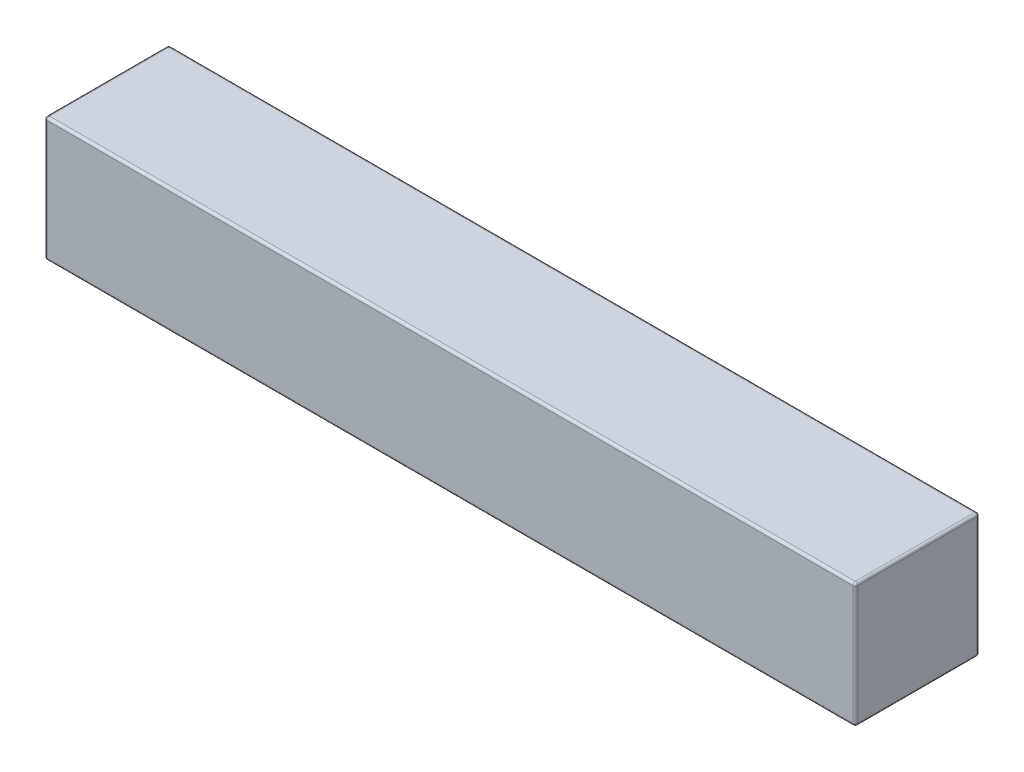
from build123d import *

# Parameters (mm, degrees)
SKETCH1_W           = 130.6
SKETCH1_H           = 20
BOSS_EXTRUDE1_DEPTH = 20
FILLET1_R           = 0.4
CUT_EXTRUDE1_DEPTH  = 0.6


with BuildPart() as part:
    # Sketch1 → Boss-Extrude1 (new body)
    with BuildSketch(Plane.XY):
        with Locations((65.3, -10)):
            Rectangle(SKETCH1_W, SKETCH1_H)
    extrude(amount=BOSS_EXTRUDE1_DEPTH)

    # Fillet1
    fillet1_edges = [part.edges().sort_by_distance(p)[0] for p in [
        (130.6, -10, 20),
        (65.3, 0, 20),
        (0, -10, 20),
        (65.3, 0, 0),
        (130.6, -10, 0),
        (65.3, -20, 0),
        (0, -10, 0),
        (0, 0, 10),
        (130.6, 0, 10),
        (130.6, -20, 10),
        (0, -20, 10),
        (65.3, -20, 20),
    ]]
    fillet(fillet1_edges, radius=FILLET1_R)

    # Sketch2 → Cut-Extrude1 (cut)
    # profile 1 of 3: a face of its own
    with BuildSketch(Plane(origin=(0, 0, 0), x_dir=(-1, 0, 0), z_dir=(0, 0, -1))):
        Polygon((-74.311809864, -16.664274914), (-80.399293588, -16.664274914), (-80.399293588, -5.330341402), (-74.311809864, -3.688322766), align=None)
    # profile 2 of 3: a face of its own
    with BuildSketch(Plane(origin=(0, 0, 0), x_dir=(-1, 0, 0), z_dir=(0, 0, -1))):
        with BuildLine():
            Line((-67.102947559, -3.688322766), (-62.001676248, -3.688322766))
            add(Edge.make_bspline(
                [(-62.001676248, -3.688322766), (-61.803847539, -3.691192153), (-61.4193959, -3.696768394), (-60.86039937, -3.740186495), (-60.336600366, -3.807905986), (-59.849916993, -3.908304084), (-59.398838813, -4.034672937), (-58.984482666, -4.192907256), (-58.604640703, -4.377105394), (-58.262702537, -4.590765283), (-57.957385082, -4.828390791), (-57.692999605, -5.092753862), (-57.467437887, -5.380387228), (-57.283146459, -5.692361334), (-57.143392021, -6.02925638), (-57.03946082, -6.386476416), (-56.978861317, -6.768382832), (-56.971675771, -7.030548765), (-56.96798802, -7.165096981)],
                knots=[0, 0, 0, 0, 1.375349436, 2.672793784, 3.896098713, 5.045225479, 6.124985035, 7.149600983, 8.125134608, 9.05553418, 9.947992634, 10.809442235, 11.648467958, 12.483230965, 13.320409496, 14.177845276, 15.064837813, 16, 16, 16, 16], degree=3))
            add(Edge.make_bspline(
                [(-56.96798802, -7.165096981), (-56.968896883, -7.248629949), (-56.970683567, -7.412842983), (-57.000595236, -7.653511603), (-57.041744799, -7.884806438), (-57.102100805, -8.105933898), (-57.180270744, -8.317712992), (-57.275108566, -8.519365095), (-57.385446142, -8.712500575), (-57.561918041, -8.95302686), (-57.819749093, -9.236440387), (-58.194096113, -9.529011101), (-58.625838121, -9.788100078), (-58.945082575, -9.920114113), (-59.110622094, -9.988568051)],
                knots=[0, 0, 0, 0, 0.790351637, 1.553710394, 2.292810862, 3.013398282, 3.720742739, 4.427557614, 5.121316443, 5.822946949, 7.24873146, 8.732957553, 10.305923149, 12, 12, 12, 12], degree=3))
            add(Edge.make_bspline(
                [(-59.110622094, -9.988568051), (-59.019362218, -10.021933806), (-58.840020082, -10.08750354), (-58.581547047, -10.198333668), (-58.343747487, -10.327536187), (-58.122855056, -10.465147283), (-57.91760425, -10.612612839), (-57.7333653, -10.776160348), (-57.5639191, -10.949157261), (-57.413255955, -11.135291681), (-57.279944132, -11.33376989), (-57.165155691, -11.544422844), (-57.066297386, -11.766759176), (-56.986249666, -12.001240338), (-56.927874363, -12.248087611), (-56.880638713, -12.505109481), (-56.857405898, -12.774903898), (-56.852723109, -12.958854093), (-56.850343393, -13.05233453)],
                knots=[0, 0, 0, 0, 1.13472865, 2.229946685, 3.280565827, 4.291721072, 5.268149148, 6.227855574, 7.164988111, 8.093264691, 9.020210702, 9.953383721, 10.891275787, 11.858815072, 12.841929431, 13.851157993, 14.907994137, 16, 16, 16, 16], degree=3))
            add(Edge.make_bspline(
                [(-56.850343393, -13.05233453), (-56.854362199, -13.188508126), (-56.862239768, -13.455432412), (-56.918833498, -13.844933377), (-57.02104354, -14.211177006), (-57.157932386, -14.555384849), (-57.33520201, -14.878143524), (-57.554716693, -15.176112335), (-57.812119185, -15.45362165), (-58.108689468, -15.707474324), (-58.447488074, -15.933590588), (-58.826423594, -16.131558311), (-59.2475016, -16.295877505), (-59.708553243, -16.42993174), (-60.210176793, -16.538196069), (-60.754247316, -16.610543629), (-61.339232875, -16.656519592), (-61.742931731, -16.661632113), (-61.951614704, -16.664274914)],
                knots=[0, 0, 0, 0, 0.924197655, 1.811590543, 2.663413052, 3.499445803, 4.320674522, 5.155478829, 6.005020483, 6.884627082, 7.798758616, 8.7638492, 9.780767373, 10.861293657, 12.019797184, 13.260379733, 14.5838154, 16, 16, 16, 16], degree=3))
            Line((-61.951614704, -16.664274914), (-67.102947559, -16.664274914))
            Line((-67.102947559, -16.664274914), (-67.102947559, -11.900919023))
            add(Edge.make_bspline(
                [(-67.102947559, -11.900919023), (-66.98581607, -11.999422847), (-66.75736759, -12.191540686), (-66.401872023, -12.443059445), (-66.050351795, -12.659282407), (-65.698656631, -12.832043937), (-65.348985533, -12.969227381), (-65.001225348, -13.067211703), (-64.65453563, -13.127637011), (-64.424052354, -13.135857199), (-64.309513416, -13.139942232)],
                knots=[0, 0, 0, 0, 1.176202588, 2.294017552, 3.344655641, 4.345878675, 5.302458846, 6.228548371, 7.119675012, 8, 8, 8, 8], degree=3))
            add(Edge.make_bspline(
                [(-64.309513416, -13.139942232), (-64.206728127, -13.136403125), (-64.0116326, -13.129685588), (-63.736652606, -13.084762325), (-63.49844065, -13.001533428), (-63.29843676, -12.886418201), (-63.136075419, -12.743033802), (-63.022008897, -12.571804987), (-62.948978956, -12.378750457), (-62.94163006, -12.242011645), (-62.937827117, -12.17125136)],
                knots=[0, 0, 0, 0, 1.309128549, 2.484841243, 3.533441366, 4.504846112, 5.40762929, 6.265257182, 7.102296604, 8, 8, 8, 8], degree=3))
            add(Edge.make_bspline(
                [(-62.937827117, -12.17125136), (-62.943082223, -12.079457221), (-62.953295623, -11.901053539), (-63.04938477, -11.648122494), (-63.206268068, -11.425717857), (-63.424785074, -11.238238131), (-63.690988917, -11.082246865), (-64.008081806, -10.973095886), (-64.368682741, -10.909220118), (-64.623788639, -10.901325138), (-64.757564233, -10.89718507)],
                knots=[0, 0, 0, 0, 0.883711761, 1.717510874, 2.573789421, 3.487312779, 4.476933462, 5.537265086, 6.708560523, 8, 8, 8, 8], degree=3))
            add(Edge.make_bspline(
                [(-64.757564233, -10.89718507), (-64.830176344, -10.899056844), (-64.983142132, -10.902999952), (-65.223275702, -10.922423073), (-65.483794923, -10.96348321), (-65.767685593, -11.008355083), (-66.071584099, -11.075925629), (-66.397482405, -11.152560882), (-66.743695223, -11.245937304), (-66.98045464, -11.31632726), (-67.102947559, -11.352745119)],
                knots=[0, 0, 0, 0, 0.727351008, 1.532248793, 2.410201151, 3.367613682, 4.40986281, 5.526519391, 6.720288021, 8, 8, 8, 8], degree=3))
            Line((-67.102947559, -11.352745119), (-67.102947559, -8.744538688))
            add(Edge.make_bspline(
                [(-67.102947559, -8.744538688), (-66.922185324, -8.779624907), (-66.566946013, -8.848577388), (-66.037352283, -8.921108533), (-65.521756333, -8.9651099), (-65.18233438, -8.971619754), (-65.015381184, -8.974821789)],
                knots=[0, 0, 0, 0, 1.050204926, 2.063893895, 3.047677679, 4, 4, 4, 4], degree=3))
            add(Edge.make_bspline(
                [(-65.015381184, -8.974821789), (-64.867428007, -8.971771116), (-64.588370709, -8.966017185), (-64.19641176, -8.902952821), (-63.855568155, -8.803153705), (-63.569245678, -8.658985073), (-63.342400277, -8.477605186), (-63.174421779, -8.268039465), (-63.073696955, -8.0260802), (-63.061612933, -7.85518751), (-63.055471744, -7.768338584)],
                knots=[0, 0, 0, 0, 1.384076768, 2.610533499, 3.705198768, 4.697403596, 5.591660459, 6.404224126, 7.189014931, 8, 8, 8, 8], degree=3))
            add(Edge.make_bspline(
                [(-63.055471744, -7.768338584), (-63.059150304, -7.693428146), (-63.066275549, -7.548329165), (-63.141206326, -7.34287945), (-63.261148132, -7.161786594), (-63.428080683, -7.008437859), (-63.633041654, -6.882032956), (-63.877177847, -6.792831034), (-64.156298501, -6.740861828), (-64.353497719, -6.735096386), (-64.45719497, -6.732064628)],
                knots=[0, 0, 0, 0, 0.915764342, 1.77380451, 2.645477239, 3.558031581, 4.532510661, 5.582118659, 6.728556571, 8, 8, 8, 8], degree=3))
            add(Edge.make_bspline(
                [(-64.45719497, -6.732064628), (-64.562645576, -6.734822754), (-64.771837784, -6.740294306), (-65.081049865, -6.803316298), (-65.3850924, -6.892852192), (-65.685189758, -7.032727161), (-65.997644781, -7.21412361), (-66.337515022, -7.444030353), (-66.71283054, -7.724354998), (-66.967951404, -7.936452636), (-67.102947559, -8.048683229)],
                knots=[0, 0, 0, 0, 0.836286464, 1.6590195, 2.497534842, 3.348733631, 4.280854859, 5.365271832, 6.605844426, 8, 8, 8, 8], degree=3))
            Line((-67.102947559, -8.048683229), (-67.102947559, -3.688322766))
        make_face()
    # profile 3 of 3: a face of its own
    with BuildSketch(Plane(origin=(0, 0, 0), x_dir=(-1, 0, 0), z_dir=(0, 0, -1))):
        with BuildLine():
            add(Edge.make_bspline(
                [(-47.644025491, -3.528125826), (-47.405120309, -3.533749146), (-46.935569795, -3.544801369), (-46.247083741, -3.636213377), (-45.589958135, -3.789224836), (-44.963292291, -4.002558155), (-44.366963078, -4.276868413), (-43.800204569, -4.611533021), (-43.265563359, -5.009011171), (-42.768873056, -5.463012747), (-42.316355479, -5.957179227), (-41.9176621, -6.481304958), (-41.583757871, -7.033629702), (-41.305169436, -7.608959135), (-41.092154795, -8.211994554), (-40.943208231, -8.840613874), (-40.846409493, -9.49329288), (-40.835952771, -9.93815862), (-40.830649382, -10.163783454)],
                knots=[0, 0, 0, 0, 1.08091634, 2.124461347, 3.136584383, 4.130109204, 5.115158958, 6.102117614, 7.103554707, 8.124668335, 9.142992306, 10.132339115, 11.099862493, 12.059179066, 13.020603964, 13.987766204, 14.97944509, 16, 16, 16, 16], degree=3))
            add(Edge.make_bspline(
                [(-40.830649382, -10.163783454), (-40.835953296, -10.390241324), (-40.846411431, -10.836765691), (-40.943211051, -11.491936366), (-41.092147008, -12.12304524), (-41.305149352, -12.728572374), (-41.58373218, -13.306398797), (-41.917587327, -13.861248816), (-42.316371226, -14.387790443), (-42.768115934, -14.884408471), (-43.265472075, -15.338810218), (-43.800612035, -15.734757792), (-44.364019476, -16.074650681), (-44.962180999, -16.346840442), (-45.588292046, -16.564747065), (-46.24776091, -16.712023137), (-46.935272704, -16.808941426), (-47.405057297, -16.819235503), (-47.644025491, -16.824471854)],
                knots=[0, 0, 0, 0, 1.022390609, 2.015926042, 2.984924162, 3.948084846, 4.908986371, 5.87790386, 6.868389237, 7.887572245, 8.906755254, 9.906298929, 10.890078441, 11.873265761, 12.869699367, 13.879057699, 14.921127348, 16, 16, 16, 16], degree=3))
            add(Edge.make_bspline(
                [(-47.644025491, -16.824471854), (-47.873789406, -16.81896884), (-48.325129349, -16.808158919), (-48.988105578, -16.714848352), (-49.623282798, -16.566291493), (-50.231015054, -16.353752394), (-50.811424098, -16.083543414), (-51.362869499, -15.74929673), (-51.887875995, -15.358171892), (-52.377091738, -14.908490909), (-52.825374277, -14.418590853), (-53.214943518, -13.891450462), (-53.548678175, -13.339810721), (-53.816528369, -12.757021475), (-54.02865134, -12.148783347), (-54.178166531, -11.511288371), (-54.270538411, -10.846502236), (-54.281587913, -10.393534181), (-54.287192351, -10.163783454)],
                knots=[0, 0, 0, 0, 1.050587883, 2.063736924, 3.056141747, 4.030234889, 5.003490218, 5.97943596, 6.974830711, 7.993314341, 9.014618856, 10.007735335, 10.986951884, 11.958596885, 12.936294876, 13.928699698, 14.949412117, 16, 16, 16, 16], degree=3))
            add(Edge.make_bspline(
                [(-54.287192351, -10.163783454), (-54.28158205, -9.934869159), (-54.270521402, -9.483567065), (-54.178242096, -8.821225103), (-54.028385224, -8.186388002), (-53.817356236, -7.579697632), (-53.54494397, -7.001764247), (-53.215819284, -6.449408523), (-52.822394141, -5.927286561), (-52.373899675, -5.439005243), (-51.886212049, -4.989142147), (-51.359582306, -4.600941021), (-50.809424298, -4.267425593), (-50.230360321, -3.994409697), (-49.6215755, -3.788117551), (-48.986680083, -3.6367815), (-48.324216704, -3.544873835), (-47.872931314, -3.53376206), (-47.644025491, -3.528125826)],
                knots=[0, 0, 0, 0, 1.048919365, 2.06793335, 3.058650414, 4.034739181, 5.006525215, 5.982501587, 6.976873358, 7.997443556, 9.018013754, 10.013164831, 10.991109993, 11.962896027, 12.941349586, 13.93206665, 14.951080635, 16, 16, 16, 16], degree=3))
        make_face()
        with BuildLine():
            add(Edge.make_bspline(
                [(-47.644025491, -10.89718507), (-47.571003755, -10.893537168), (-47.428173606, -10.88640189), (-47.225661316, -10.824886914), (-47.044067568, -10.723858037), (-46.887894394, -10.585399789), (-46.755696898, -10.417941586), (-46.663960427, -10.222468354), (-46.605759497, -10.006081496), (-46.60048476, -9.854635224), (-46.597739226, -9.77580649)],
                knots=[0, 0, 0, 0, 1.018881225, 1.992926546, 2.927422151, 3.902723315, 4.891802264, 5.88807411, 6.90072932, 8, 8, 8, 8], degree=3))
            add(Edge.make_bspline(
                [(-46.597739226, -9.77580649), (-46.600677704, -9.697856077), (-46.606382563, -9.546520589), (-46.662884652, -9.330423944), (-46.756374977, -9.135561036), (-46.888686101, -8.968899533), (-47.043530707, -8.826667358), (-47.227153281, -8.728080004), (-47.428794425, -8.664713618), (-47.570942866, -8.657920465), (-47.644025491, -8.654427909)],
                knots=[0, 0, 0, 0, 1.088197911, 2.112663107, 3.098941009, 4.088526265, 5.072039542, 6.017223407, 6.980597211, 8, 8, 8, 8], degree=3))
            add(Edge.make_bspline(
                [(-47.644025491, -8.654427909), (-47.697928575, -8.657561267), (-47.806123472, -8.663850581), (-47.963249075, -8.723883225), (-48.11268737, -8.818455253), (-48.250442964, -8.948518417), (-48.374515936, -9.108415801), (-48.457154596, -9.306034522), (-48.512043769, -9.530872698), (-48.517317494, -9.691160011), (-48.520102507, -9.77580649)],
                knots=[0, 0, 0, 0, 0.816022871, 1.637930599, 2.520626141, 3.489230652, 4.503212198, 5.570078484, 6.71677741, 8, 8, 8, 8], degree=3))
            add(Edge.make_bspline(
                [(-48.520102507, -9.77580649), (-48.516963542, -9.8611967), (-48.511023961, -10.022772944), (-48.460856131, -10.250247284), (-48.376683759, -10.448049603), (-48.253728299, -10.608014603), (-48.115072217, -10.735916799), (-47.964485055, -10.828069885), (-47.806866942, -10.887506722), (-47.697913733, -10.893982267), (-47.644025491, -10.89718507)],
                knots=[0, 0, 0, 0, 1.292826198, 2.44629919, 3.510661767, 4.522263713, 5.480035619, 6.354007158, 7.185892161, 8, 8, 8, 8], degree=3))
        make_face(mode=Mode.SUBTRACT)
    extrude(amount=-CUT_EXTRUDE1_DEPTH, mode=Mode.SUBTRACT)


solid = part.part
